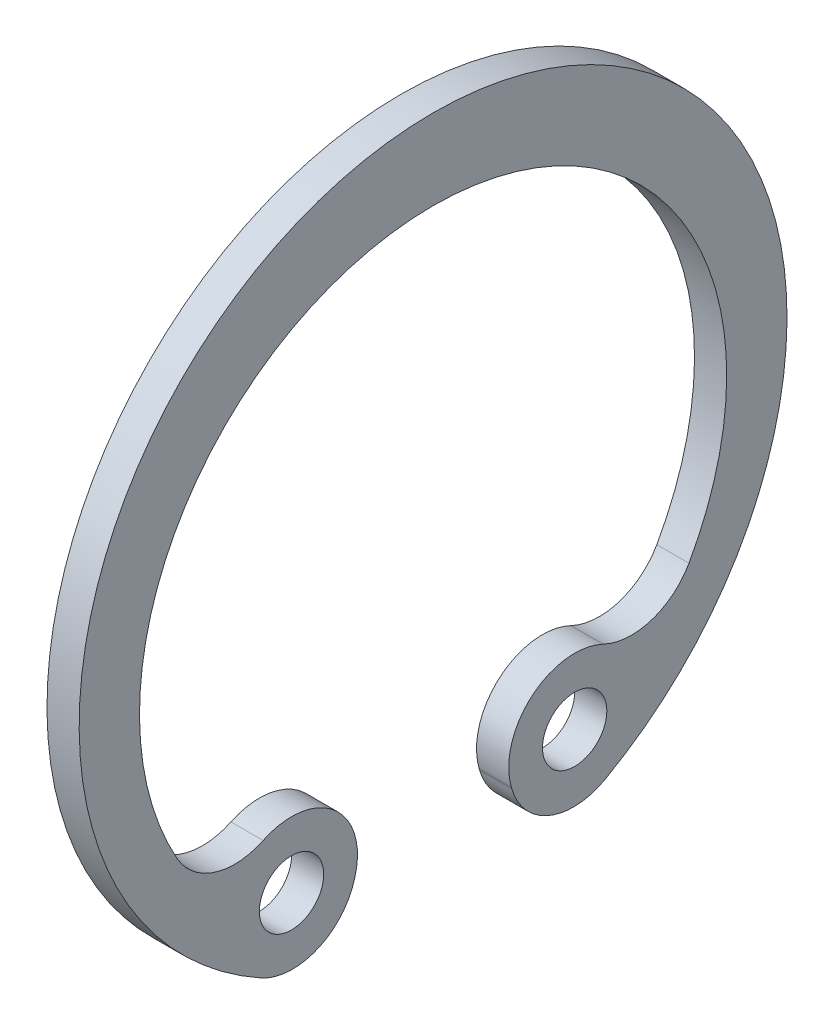
from build123d import *

# Parameters (mm, degrees)
BOSS_EXTRUDE1_DEPTH      = 0.5
BOSS_EXTRUDE1_DEPTH_BACK = 0.5
SKETCH1_R                = 1


with BuildPart() as part:
    # Sketch1 → Boss-Extrude1 (new, two sides: drawn at the far end of the back side and taken through both)
    with BuildSketch(Plane(origin=(0, 0, 0), x_dir=(0, 0, -1), z_dir=(1, 0, 0)).offset(-BOSS_EXTRUDE1_DEPTH_BACK)):
        with BuildLine():
            Line((-2.449013309, -8.426288258), (-2.431457432, -8.365883979))
            ThreePointArc((-2.431457432, -8.365883979), (-3.072894616, -6.231284279), (-5.28316064, -5.94374012))
            ThreePointArc((-5.28316064, -5.94374012), (-6.784849627, -6.048194996), (-7.953029213, -5.098807252))
            ThreePointArc((-7.953029213, -5.098807252), (0, 8.5), (7.953029213, -5.098807252))
            ThreePointArc((7.953029213, -5.098807252), (6.784849627, -6.048194996), (5.28316064, -5.94374012))
            ThreePointArc((5.28316064, -5.94374012), (3.072894616, -6.231284279), (2.431457432, -8.365883979))
            Line((2.431457432, -8.365883979), (2.449013309, -8.426288258))
            ThreePointArc((2.449013309, -8.426288258), (3.608233074, -9.717540759), (5.34055212, -9.616574393))
            ThreePointArc((5.34055212, -9.616574393), (0, 11), (-5.34055212, -9.616574393))
            ThreePointArc((-5.34055212, -9.616574393), (-3.608233074, -9.717540759), (-2.449013309, -8.426288258))
        make_face()
        with Locations((4.4, -7.793747494)):
            Circle(SKETCH1_R, mode=Mode.SUBTRACT)
        with Locations((-4.4, -7.793747494)):
            Circle(SKETCH1_R, mode=Mode.SUBTRACT)
    extrude(amount=BOSS_EXTRUDE1_DEPTH + BOSS_EXTRUDE1_DEPTH_BACK)


solid = part.part
